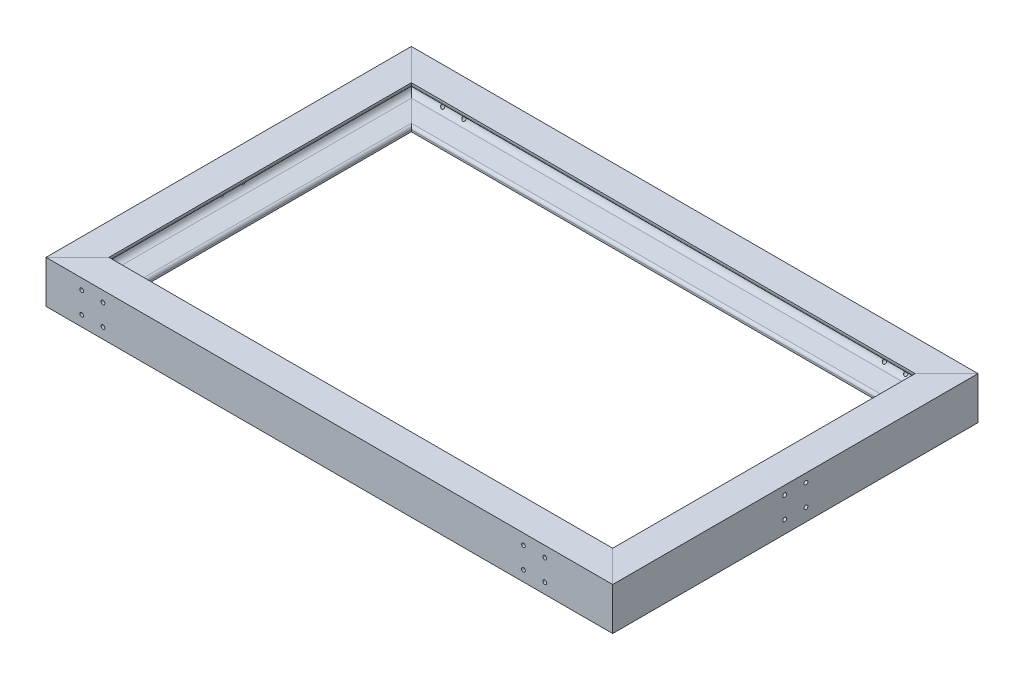
from build123d import *

# Parameters (mm, degrees)
GB_T706_2008_5_1_DEPTH      = 63.20128616
GB_T706_2008_5_1_DEPTH_BACK = 730.20128616
GB_T706_2008_5_1_2_DEPTH    = 556.402572321
GB_T706_2008_5_1_3_DEPTH    = 793.402572321
GB_T706_2008_5_1_4_DEPTH    = 556.402572321
CUT_EXTRUDE_1_DEPTH         = 400.934057064
PATTERN_LINEAR_1_COUNT      = 2
PATTERN_LINEAR_1_PITCH      = 520
CUT_EXTRUDE_2_DEPTH         = 703.576686236
CUT_EXTRUDE_2_DEPTH_BACK    = 703.576686236


with BuildPart() as part:
    # Sketch17 → 热轧槽钢gb∕t706-2008 5(1) (new, two sides: drawn at the far end of the back side and taken through both)
    with BuildSketch(Plane(origin=(-333.5, 0, -215), x_dir=(0, 0, 1), z_dir=(-1, 0, 0)).offset(-GB_T706_2008_5_1_DEPTH_BACK)):
        with BuildLine():
            Line((37, 50), (0, 50))
            Line((0, 50), (0, 0))
            Line((0, 0), (37, 0))
            Line((37, 0), (37, 2.140642022))
            ThreePointArc((37, 2.140642022), (36.101006889, 4.482599144), (33.865849621, 5.621468656))
            Line((33.865849621, 5.621468656), (10.768300757, 8.049118866))
            ThreePointArc((10.768300757, 8.049118866), (6.297986222, 10.326857889), (4.5, 15.010772133))
            Line((4.5, 15.010772133), (4.5, 34.989227867))
            ThreePointArc((4.5, 34.989227867), (6.297986222, 39.673142111), (10.768300757, 41.950881134))
            Line((10.768300757, 41.950881134), (33.865849621, 44.378531344))
            ThreePointArc((33.865849621, 44.378531344), (36.101006889, 45.517400856), (37, 47.859357978))
            Line((37, 47.859357978), (37, 50))
        make_face()
    extrude(amount=GB_T706_2008_5_1_DEPTH + GB_T706_2008_5_1_DEPTH_BACK)

    # 热轧槽钢gb∕t706-2008 5(1) mitre 1
    split(bisect_by=Plane(origin=(-333.5, 0, -215), x_dir=(0, 1, 0), z_dir=(0.707106781, 0, -0.707106781)), keep=Keep.TOP)

    # 热轧槽钢gb∕t706-2008 5(1) mitre 2
    split(bisect_by=Plane(origin=(333.5, 0, -215), x_dir=(0, -1, 0), z_dir=(-0.707106781, 0, -0.707106781)), keep=Keep.TOP)


with BuildPart() as body_2:
    # Sketch17 on segment 2 (carried to segment 2) → gb_t706-2008 5_1 2 (new body)
    with BuildSketch(Plane(origin=(333.5, 0, 278.20128616), x_dir=(-1, 0, 0), z_dir=(0, 0, -1))):
        with BuildLine():
            Line((37, 50), (0, 50))
            Line((0, 50), (0, 0))
            Line((0, 0), (37, 0))
            Line((37, 0), (37, 2.140642022))
            ThreePointArc((37, 2.140642022), (36.101006889, 4.482599144), (33.865849621, 5.621468656))
            Line((33.865849621, 5.621468656), (10.768300757, 8.049118866))
            ThreePointArc((10.768300757, 8.049118866), (6.297986222, 10.326857889), (4.5, 15.010772133))
            Line((4.5, 15.010772133), (4.5, 34.989227867))
            ThreePointArc((4.5, 34.989227867), (6.297986222, 39.673142111), (10.768300757, 41.950881134))
            Line((10.768300757, 41.950881134), (33.865849621, 44.378531344))
            ThreePointArc((33.865849621, 44.378531344), (36.101006889, 45.517400856), (37, 47.859357978))
            Line((37, 47.859357978), (37, 50))
        make_face()
    extrude(amount=GB_T706_2008_5_1_2_DEPTH)

    # gb_t706-2008 5_1 2 mitre 1
    split(bisect_by=Plane(origin=(333.5, 0, -215), x_dir=(0, 1, 0), z_dir=(0.707106781, 0, 0.707106781)), keep=Keep.TOP)

    # gb_t706-2008 5_1 2 mitre 2
    split(bisect_by=Plane(origin=(333.5, 0, 215), x_dir=(0, 1, 0), z_dir=(0.707106781, 0, -0.707106781)), keep=Keep.TOP)


with BuildPart() as body_3:
    # Sketch17 on segment 3 (carried to segment 3) → gb_t706-2008 5_1 3 (new body)
    with BuildSketch(Plane(origin=(-396.70128616, 0, 215), x_dir=(0, 0, -1), z_dir=(1, 0, 0))):
        with BuildLine():
            Line((37, 50), (0, 50))
            Line((0, 50), (0, 0))
            Line((0, 0), (37, 0))
            Line((37, 0), (37, 2.140642022))
            ThreePointArc((37, 2.140642022), (36.101006889, 4.482599144), (33.865849621, 5.621468656))
            Line((33.865849621, 5.621468656), (10.768300757, 8.049118866))
            ThreePointArc((10.768300757, 8.049118866), (6.297986222, 10.326857889), (4.5, 15.010772133))
            Line((4.5, 15.010772133), (4.5, 34.989227867))
            ThreePointArc((4.5, 34.989227867), (6.297986222, 39.673142111), (10.768300757, 41.950881134))
            Line((10.768300757, 41.950881134), (33.865849621, 44.378531344))
            ThreePointArc((33.865849621, 44.378531344), (36.101006889, 45.517400856), (37, 47.859357978))
            Line((37, 47.859357978), (37, 50))
        make_face()
    extrude(amount=GB_T706_2008_5_1_3_DEPTH)

    # gb_t706-2008 5_1 3 mitre 1
    split(bisect_by=Plane(origin=(-333.5, 0, 215), x_dir=(0, 1, 0), z_dir=(0.707106781, 0, 0.707106781)), keep=Keep.TOP)

    # gb_t706-2008 5_1 3 mitre 2
    split(bisect_by=Plane(origin=(333.5, 0, 215), x_dir=(0, -1, 0), z_dir=(-0.707106781, 0, 0.707106781)), keep=Keep.TOP)


with BuildPart() as body_4:
    # Sketch17 on segment 4 (carried to segment 4) → gb_t706-2008 5_1 4 (new body)
    with BuildSketch(Plane(origin=(-333.5, 0, -278.20128616), x_dir=(1, 0, 0), z_dir=(0, 0, 1))):
        with BuildLine():
            Line((37, 50), (0, 50))
            Line((0, 50), (0, 0))
            Line((0, 0), (37, 0))
            Line((37, 0), (37, 2.140642022))
            ThreePointArc((37, 2.140642022), (36.101006889, 4.482599144), (33.865849621, 5.621468656))
            Line((33.865849621, 5.621468656), (10.768300757, 8.049118866))
            ThreePointArc((10.768300757, 8.049118866), (6.297986222, 10.326857889), (4.5, 15.010772133))
            Line((4.5, 15.010772133), (4.5, 34.989227867))
            ThreePointArc((4.5, 34.989227867), (6.297986222, 39.673142111), (10.768300757, 41.950881134))
            Line((10.768300757, 41.950881134), (33.865849621, 44.378531344))
            ThreePointArc((33.865849621, 44.378531344), (36.101006889, 45.517400856), (37, 47.859357978))
            Line((37, 47.859357978), (37, 50))
        make_face()
    extrude(amount=GB_T706_2008_5_1_4_DEPTH)

    # gb_t706-2008 5_1 4 mitre 1
    split(bisect_by=Plane(origin=(-333.5, 0, -215), x_dir=(0, -1, 0), z_dir=(-0.707106781, 0, 0.707106781)), keep=Keep.TOP)

    # gb_t706-2008 5_1 4 mitre 2
    split(bisect_by=Plane(origin=(-333.5, 0, 215), x_dir=(0, -1, 0), z_dir=(-0.707106781, 0, -0.707106781)), keep=Keep.TOP)


with BuildPart() as cut_extrude_1_tool:
    # 草图10 → 切除-拉伸1 (new, symmetric)
    with BuildSketch(Plane.XY):
        with BuildLine():
            ThreePointArc((251.25, 37.5), (251.909009742, 35.909009742), (253.5, 35.25))
            Line((253.5, 35.25), (253.5, 37.5))
            Line((253.5, 37.5), (251.25, 37.5))
        make_face()
        with BuildLine():
            Line((253.5, 37.5), (253.5, 35.25))
            ThreePointArc((253.5, 35.25), (255.090990258, 35.909009742), (255.75, 37.5))
            ThreePointArc((255.75, 37.5), (253.5, 39.75), (251.25, 37.5))
            Line((251.25, 37.5), (253.5, 37.5))
        make_face()
        with BuildLine():
            ThreePointArc((230.75, 37.5), (226.909009742, 39.090990258), (228.5, 35.25))
            Line((228.5, 35.25), (228.5, 37.5))
            Line((228.5, 37.5), (230.75, 37.5))
        make_face()
        with BuildLine():
            Line((228.5, 37.5), (228.5, 35.25))
            ThreePointArc((228.5, 35.25), (230.090990258, 35.909009742), (230.75, 37.5))
            Line((230.75, 37.5), (228.5, 37.5))
        make_face()
        with BuildLine():
            ThreePointArc((253.5, 14.75), (251.909009742, 14.090990258), (251.25, 12.5))
            Line((251.25, 12.5), (253.5, 12.5))
            Line((253.5, 12.5), (253.5, 14.75))
        make_face()
        with BuildLine():
            Line((253.5, 12.5), (251.25, 12.5))
            ThreePointArc((251.25, 12.5), (253.5, 10.25), (255.75, 12.5))
            ThreePointArc((255.75, 12.5), (255.090990258, 14.090990258), (253.5, 14.75))
            Line((253.5, 14.75), (253.5, 12.5))
        make_face()
        with BuildLine():
            ThreePointArc((228.5, 14.75), (226.909009742, 10.909009742), (230.75, 12.5))
            Line((230.75, 12.5), (228.5, 12.5))
            Line((228.5, 12.5), (228.5, 14.75))
        make_face()
        with BuildLine():
            Line((228.5, 12.5), (230.75, 12.5))
            ThreePointArc((230.75, 12.5), (230.090990258, 14.090990258), (228.5, 14.75))
            Line((228.5, 14.75), (228.5, 12.5))
        make_face()
    cut_extrude_1 = extrude(amount=CUT_EXTRUDE_1_DEPTH, both=True)


with BuildPart() as part_1:
    add(part.part)

    # 切除-拉伸1: cut by cut_extrude_1_tool
    add(cut_extrude_1_tool.part, mode=Mode.SUBTRACT)


with BuildPart() as body_3_1:
    add(body_3.part)

    # 切除-拉伸1: cut by cut_extrude_1_tool
    add(cut_extrude_1_tool.part, mode=Mode.SUBTRACT)


with BuildPart() as pattern_linear_1_tool:
    # 阵列(线性)1: 切除-拉伸1 ×2
    with Locations(*[(-i * PATTERN_LINEAR_1_PITCH, 0, 0) for i in range(1, PATTERN_LINEAR_1_COUNT)]):
        add(cut_extrude_1)


with BuildPart() as part_2:
    add(part_1.part)

    # 阵列(线性)1: cut by pattern_linear_1_tool
    add(pattern_linear_1_tool.part, mode=Mode.SUBTRACT)


with BuildPart() as body_3_2:
    add(body_3_1.part)

    # 阵列(线性)1: cut by pattern_linear_1_tool
    add(pattern_linear_1_tool.part, mode=Mode.SUBTRACT)


with BuildPart() as cut_extrude_2_tool:
    # 草图11 → 切除-拉伸2 (new, two sides: drawn at the far end of the back side and taken through both)
    with BuildSketch(Plane(origin=(333.5, 0, 0), x_dir=(0, 0, -1), z_dir=(1, 0, 0)).offset(-CUT_EXTRUDE_2_DEPTH_BACK)):
        with BuildLine():
            Line((-12.5, 37.75), (-12.5, 40))
            Line((-12.5, 40), (-10.25, 40))
            ThreePointArc((-10.25, 40), (-14.090990258, 41.590990258), (-12.5, 37.75))
        make_face()
        with BuildLine():
            Line((-10.25, 40), (-12.5, 40))
            Line((-12.5, 40), (-12.5, 37.75))
            ThreePointArc((-12.5, 37.75), (-10.909009742, 38.409009742), (-10.25, 40))
        make_face()
        with BuildLine():
            ThreePointArc((-10.25, 15), (-10.909009742, 16.590990258), (-12.5, 17.25))
            Line((-12.5, 17.25), (-12.5, 15))
            Line((-12.5, 15), (-10.25, 15))
        make_face()
        with BuildLine():
            Line((-12.5, 15), (-12.5, 17.25))
            ThreePointArc((-12.5, 17.25), (-14.090990258, 13.409009742), (-10.25, 15))
            Line((-10.25, 15), (-12.5, 15))
        make_face()
        with BuildLine():
            ThreePointArc((14.75, 15), (14.090990258, 16.590990258), (12.5, 17.25))
            Line((12.5, 17.25), (12.5, 15))
            Line((12.5, 15), (10.25, 15))
            ThreePointArc((10.25, 15), (12.5, 12.75), (14.75, 15))
        make_face()
        with BuildLine():
            Line((12.5, 15), (12.5, 17.25))
            ThreePointArc((12.5, 17.25), (10.909009742, 16.590990258), (10.25, 15))
            Line((10.25, 15), (12.5, 15))
        make_face()
        with BuildLine():
            ThreePointArc((14.75, 40), (12.5, 42.25), (10.25, 40))
            Line((10.25, 40), (12.5, 40))
            Line((12.5, 40), (12.5, 37.75))
            ThreePointArc((12.5, 37.75), (14.090990258, 38.409009742), (14.75, 40))
        make_face()
        with BuildLine():
            Line((12.5, 40), (10.25, 40))
            ThreePointArc((10.25, 40), (10.909009742, 38.409009742), (12.5, 37.75))
            Line((12.5, 37.75), (12.5, 40))
        make_face()
    extrude(amount=CUT_EXTRUDE_2_DEPTH + CUT_EXTRUDE_2_DEPTH_BACK)


with BuildPart() as body_2_1:
    add(body_2.part)

    # 切除-拉伸2: cut by cut_extrude_2_tool
    add(cut_extrude_2_tool.part, mode=Mode.SUBTRACT)


with BuildPart() as body_4_1:
    add(body_4.part)

    # 切除-拉伸2: cut by cut_extrude_2_tool
    add(cut_extrude_2_tool.part, mode=Mode.SUBTRACT)


solid = Compound([part_2.part, body_3_2.part, body_2_1.part, body_4_1.part])
